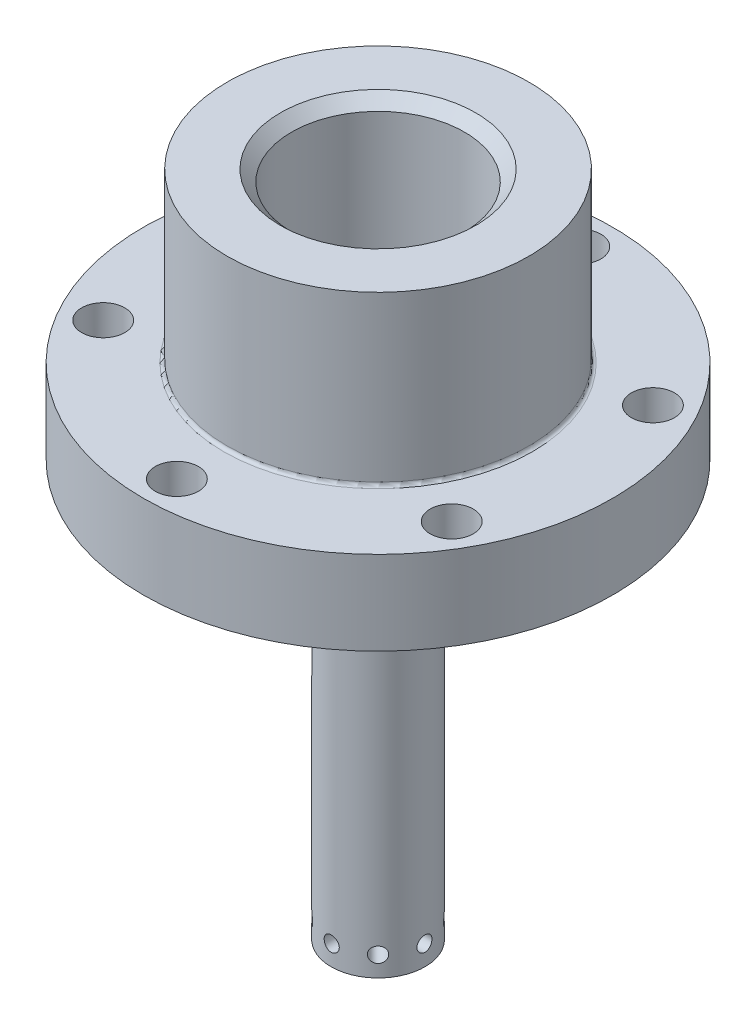
from build123d import *
from build123d.topology import SkipClean

# Parameters (mm, degrees)
SKETCH1_W           = 2.032
SKETCH1_H           = 25.146
CUT_EXTRUDE1_REACH  = 26.41
SKETCH2_R           = 0.5715
CIRPATTERN1_COUNT   = 8
SKETCH3_R           = 3.556
SKETCH3_R_2         = 1.524
BOSS_EXTRUDE1_DEPTH = 6.35
BOSS_EXTRUDE2_START = 6.35
SKETCH4_R           = 17.78
SKETCH4_R_2         = 1.524
BOSS_EXTRUDE2_DEPTH = 6.35
CUT_EXTRUDE2_REACH  = 47.438
SKETCH11_R          = 1.63195
CIRPATTERN2_COUNT   = 6
CHAMFER1_SIZE       = 3.048
CHAMFER1_SIZE2      = 5.279290861
SKETCH13_R          = 11.43
SKETCH13_R_2        = 6.54812
BOSS_EXTRUDE4_DEPTH = 12.7
FILLET4_R           = 0.254
CHAMFER2_SIZE       = 0.851662
CHAMFER2_SIZE2      = 0.83947
BOSS_EXTRUDE5_START = 6.35
SKETCH15_R          = 4.699
SKETCH15_R_2        = 3.556
BOSS_EXTRUDE5_DEPTH = 6.35


with BuildPart() as part:
    # Sketch1 → Revolve2 (revolve)
    with BuildSketch(Plane.XY):
        with Locations((-2.54, 10.505774136)):
            Rectangle(SKETCH1_W, SKETCH1_H)
    revolve(axis=Axis((0, 8.215698649, 0), (0, -1, 0)))

    # Sketch2 → Cut-Extrude1 (cut, up to next)
    with BuildSketch(Plane.ZY.offset(3.556), mode=Mode.PRIVATE) as cut_extrude1_sk1:
        with Locations((0.000240101, -0.543225864)):
            Circle(SKETCH2_R)
    cut_extrude1_tool1 = extrude(cut_extrude1_sk1.sketch, amount=-CUT_EXTRUDE1_REACH, mode=Mode.PRIVATE) & part.part
    cut_extrude1 = cut_extrude1_tool1.solids().sort_by_distance((-3.556, -0.543226, 0.00024))[0]
    add(cut_extrude1, mode=Mode.SUBTRACT)

    # CirPattern1: Cut-Extrude1 ×8 about axis
    cirpattern1_axis = Axis((0, -2.067225864, 0), (0, 1, 0))
    for i in range(1, CIRPATTERN1_COUNT):
        add(cut_extrude1.rotate(cirpattern1_axis, i * 360 / CIRPATTERN1_COUNT), mode=Mode.SUBTRACT)

    # Sketch3 → Boss-Extrude1 (add)
    with BuildSketch(Plane(origin=(0, 23.078774136, 0), x_dir=(-1, 0, 0), z_dir=(0, -1, 0))):
        Circle(SKETCH3_R)
        Circle(SKETCH3_R_2, mode=Mode.SUBTRACT)
    extrude(amount=-BOSS_EXTRUDE1_DEPTH)

    # Sketch4 → Boss-Extrude2 (add)
    with SkipClean():  # the faces are left unmerged after this step: merging them gives an invalid solid
        with BuildSketch(Plane(origin=(0, 29.428774136, 0), x_dir=(1, 0, 0), z_dir=(0, 1, 0)).offset(BOSS_EXTRUDE2_START)):
            Circle(SKETCH4_R)
            Circle(SKETCH4_R_2, mode=Mode.SUBTRACT)
        extrude(amount=-BOSS_EXTRUDE2_DEPTH)

    # Sketch11 → Cut-Extrude2 (cut, up to next)
    with BuildSketch(Plane(origin=(0, 35.778774136, 0), x_dir=(1, 0, 0), z_dir=(0, 1, 0)), mode=Mode.PRIVATE) as cut_extrude2_sk1:
        with Locations((0, -15.24)):
            Circle(SKETCH11_R)
    cut_extrude2_tool1 = extrude(cut_extrude2_sk1.sketch, amount=-CUT_EXTRUDE2_REACH, mode=Mode.PRIVATE) & part.part
    cut_extrude2 = cut_extrude2_tool1.solids().sort_by_distance((0, 35.778774, 15.24))[0]
    add(cut_extrude2, mode=Mode.SUBTRACT)

    # CirPattern2: Cut-Extrude2 ×6 about axis
    with SkipClean():  # the faces are left unmerged after this step: merging them gives an invalid solid
        cirpattern2_axis = Axis((0, -2.067225864, 0), (0, 1, 0))
        for i in range(1, CIRPATTERN2_COUNT):
            add(cut_extrude2.rotate(cirpattern2_axis, i * 360 / CIRPATTERN2_COUNT), mode=Mode.SUBTRACT)

    # Chamfer1
    chamfer1_edges = [part.edges().sort_by_distance(p)[0] for p in [
        (-1.524, 35.778774136, 0),
    ]]
    chamfer1_side = [part.faces().sort_by_distance(p)[0] for p in [
        (-17.277105657, 35.778774136, 0),
    ]]
    chamfer(chamfer1_edges, length=CHAMFER1_SIZE, length2=CHAMFER1_SIZE2, reference=chamfer1_side[0])

    # Sketch13 → Boss-Extrude4 (add)
    with SkipClean():  # the faces are left unmerged after this step: merging them gives an invalid solid
        with BuildSketch(Plane(origin=(0, 35.778774136, 0), x_dir=(1, 0, 0), z_dir=(0, 1, 0))):
            Circle(SKETCH13_R)
            Circle(SKETCH13_R_2, mode=Mode.SUBTRACT)
        extrude(amount=BOSS_EXTRUDE4_DEPTH)

    # Fillet4
    fillet4_edges = [part.edges().sort_by_distance(p)[0] for p in [
        (-11.43, 35.778774136, 0),
    ]]
    fillet(fillet4_edges, radius=FILLET4_R)

    # Chamfer2
    chamfer2_edges = [part.edges().sort_by_distance(p)[0] for p in [
        (-6.54812, 48.478774136, 0),
    ]]
    chamfer2_side = [part.faces().sort_by_distance(p)[0] for p in [
        (-11.10671078, 48.478774136, 0),
    ]]
    chamfer(chamfer2_edges, length=CHAMFER2_SIZE, length2=CHAMFER2_SIZE2, reference=chamfer2_side[0])

    # Sketch15 → Boss-Extrude5 (add)
    with SkipClean():  # the faces are left unmerged after this step: merging them gives an invalid solid
        with BuildSketch(Plane.XZ.offset(-29.428774136).offset(BOSS_EXTRUDE5_START)):
            Circle(SKETCH15_R)
            Circle(SKETCH15_R_2, mode=Mode.SUBTRACT)
        extrude(amount=-BOSS_EXTRUDE5_DEPTH)


solid = part.part
